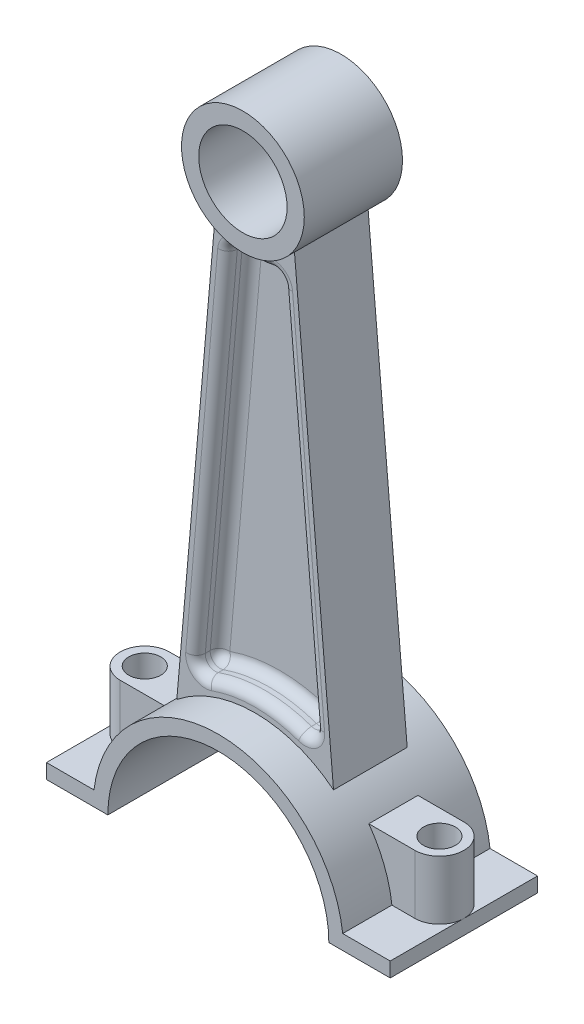
from build123d import *

# Parameters (mm, degrees)
SKETCH2_R           = 9
BOSS_EXTRUDE1_DEPTH = 10
BOSS_EXTRUDE2_DEPTH = 15
BOSS_EXTRUDE3_DEPTH = 7.5
CUT_EXTRUDE2_START  = 7.5
CUT_EXTRUDE2_DEPTH  = 4.999999999999999
BOSS_EXTRUDE8_REACH = 149.366
BOSS_EXTRUDE8_START = 12
SKETCH4_14_R        = 3.2499999999999973
CUT_EXTRUDE3_DEPTH  = 136.3662070089873
FILLET1_R           = 2
FILLET5_R           = 2


with BuildPart() as part:
    # Sketch2 → Boss-Extrude1 (new, symmetric)
    with BuildSketch(Plane.XY):
        with BuildLine():
            ThreePointArc((12.5, 0), (-5.303300858899107, 11.31923142267177), (-7.999999999999999, -9.604686356149275))
            ThreePointArc((-7.999999999999999, -9.604686356149275), (-2.3e-15, -12.5), (7.9999999999999964, -9.604686356149276))
            ThreePointArc((7.9999999999999964, -9.604686356149276), (11.319231422671766, -5.3033008588991155), (12.5, -3.06e-15))
        make_face()
        Circle(SKETCH2_R, mode=Mode.SUBTRACT)
    extrude(amount=BOSS_EXTRUDE1_DEPTH, both=True)



with BuildPart() as body_2:
    # Sketch2<3> → Boss-Extrude2 (new, symmetric)
    with BuildSketch(Plane.XY):
        with BuildLine():
            Line((-25.322914524201188, -117.4), (-35, -117.4))
            Line((-35, -117.4), (-35, -120.4))
            Line((-35, -120.4), (-22.49999999999999, -120.4))
            ThreePointArc((-22.499999999999986, -120.4), (1.194e-14, -97.9), (22.500000000000014, -120.4))
            Line((22.500000000000018, -120.4), (35, -120.4))
            Line((35, -120.4), (35, -117.4))
            Line((35, -117.4), (25.322914524201217, -117.4))
            ThreePointArc((25.322914524201213, -117.4), (1.643e-14, -94.9), (-25.32291452420118, -117.4))
        make_face()
    extrude(amount=BOSS_EXTRUDE2_DEPTH, both=True)


with BuildPart() as part_1:
    add(part.part)

    add(body_2.part)  # Boss-Extrude3 merges body 2
    # Sketch2<4> → Boss-Extrude3 (add, symmetric)
    with BuildSketch(Plane.XY):
        with BuildLine():
            ThreePointArc((8, -9.604686356149275), (1.78e-15, -12.5), (-8, -9.604686356149275))
            Line((-7.999999999999998, -9.604686356149276), (-15.952867935585848, -100.50638281684913))
            ThreePointArc((-15.952867935585854, -100.50638281684911), (1.688e-14, -94.9), (15.952867935585882, -100.50638281684911))
            Line((15.952867935585875, -100.50638281684913), (8.000000000000002, -9.604686356149275))
        make_face()
    extrude(amount=BOSS_EXTRUDE3_DEPTH, both=True)

    # Sketch3 → Cut-Extrude2 (cut)
    with BuildSketch(Plane.XY.offset(CUT_EXTRUDE2_START)):
        with BuildLine():
            Line((-5.4187458002182325, -14.521955582930875), (-12.438451254570133, -94.75755607615214))
            ThreePointArc((-12.438451254570133, -94.75755607615214), (1.649e-14, -91.9), (12.438451254570163, -94.75755607615214))
            Line((12.438451254570163, -94.75755607615214), (5.418745800218236, -14.521955582930875))
            ThreePointArc((5.418745800218236, -14.521955582930875), (9.5e-16, -15.499999999999998), (-5.4187458002182325, -14.521955582930875))
        make_face()
    cut_extrude2 = extrude(amount=-CUT_EXTRUDE2_DEPTH, mode=Mode.SUBTRACT)

    # Mirror1: Cut-Extrude2 across plane
    add(cut_extrude2.mirror(Plane.XY), mode=Mode.SUBTRACT)

    # Sketch4 → Boss-Extrude8 (add, up to next)
    with BuildSketch(Plane(origin=(0, -117.4, 0), x_dir=(1, 0, 0), z_dir=(0, 1, 0)).offset(BOSS_EXTRUDE8_START), mode=Mode.PRIVATE) as boss_extrude8_sk1:
        with BuildLine():
            Line((18.000000000000004, 5.0195959671732515), (18.000000000000004, -4.9804040328267485))
            Line((18.000000000000004, -4.980404032826749), (30.000000000000004, -4.980404032826749))
            ThreePointArc((30.000000000000004, -4.980404032826749), (35, 0.01959596717325077), (30.000000000000004, 5.019595967173251))
            Line((30.000000000000004, 5.019595967173251), (18.000000000000004, 5.0195959671732515))
        make_face()
    boss_extrude8_tool1 = extrude(boss_extrude8_sk1.sketch, amount=-BOSS_EXTRUDE8_REACH, mode=Mode.PRIVATE) - part_1.part
    boss_extrude8 = boss_extrude8_tool1.solids().sort_by_distance((26.002593, -105.4, -0.019596))[0]
    add(boss_extrude8)

    # Sketch4<14> → Cut-Extrude3 (cut, symmetric)
    with BuildSketch(Plane(origin=(0, -117.4, 0), x_dir=(1, 0, 0), z_dir=(0, 1, 0))):
        with Locations((30.000000000000004, 0.01959596717325107)):
            Circle(SKETCH4_14_R)
    cut_extrude3 = extrude(amount=CUT_EXTRUDE3_DEPTH, both=True, mode=Mode.SUBTRACT)

    # Mirror2: Boss-Extrude8, Cut-Extrude3 across plane
    add(boss_extrude8.mirror(Plane(origin=(0, 0, 0), x_dir=(0, 0, 1), z_dir=(1, 0, 0))))
    add(cut_extrude3.mirror(Plane(origin=(0, 0, 0), x_dir=(0, 0, 1), z_dir=(1, 0, 0))), mode=Mode.SUBTRACT)

    # Fillet1
    fillet1_edges = [part_1.edges().sort_by_distance(p)[0] for p in [
        (12.438451254570161, -94.75755607615214, -5),
        (-12.438451254570133, -94.75755607615214, -5),
        (1.199e-14, -91.9, -7.5),
        (1.199e-14, -91.9, -2.500000000000001),
        (8.928598527394199, -54.63975582954151, -7.5),
        (8.928598527394199, -54.63975582954151, -2.500000000000001),
        (5.418745800218236, -14.521955582930875, -5),
        (-5.418745800218234, -14.521955582930875, -5),
        (-8.928598527394183, -54.639755829541514, -2.500000000000001),
        (0, -15.499999999999996, -2.500000000000001),
        (-8.928598527394183, -54.639755829541514, -7.5),
        (0, -15.499999999999996, -7.5),
    ]]
    fillet(fillet1_edges, radius=FILLET1_R)

    # Fillet5
    fillet5_edges = [part_1.edges().sort_by_distance(p)[0] for p in [
        (-5.418745800218234, -14.521955582930875, 5),
        (5.418745800218236, -14.521955582930875, 5),
        (12.438451254570161, -94.75755607615214, 5),
        (-12.438451254570133, -94.75755607615214, 5),
        (1.199e-14, -91.9, 2.500000000000001),
        (1.199e-14, -91.9, 7.5),
        (8.9285985273942, -54.63975582954151, 2.500000000000001),
        (8.9285985273942, -54.63975582954151, 7.5),
        (0, -15.499999999999996, 7.5),
        (-8.928598527394183, -54.639755829541514, 2.500000000000001),
        (-8.928598527394183, -54.639755829541514, 7.5),
        (0, -15.499999999999996, 2.500000000000001),
    ]]
    fillet(fillet5_edges, radius=FILLET5_R)


solid = part_1.part
